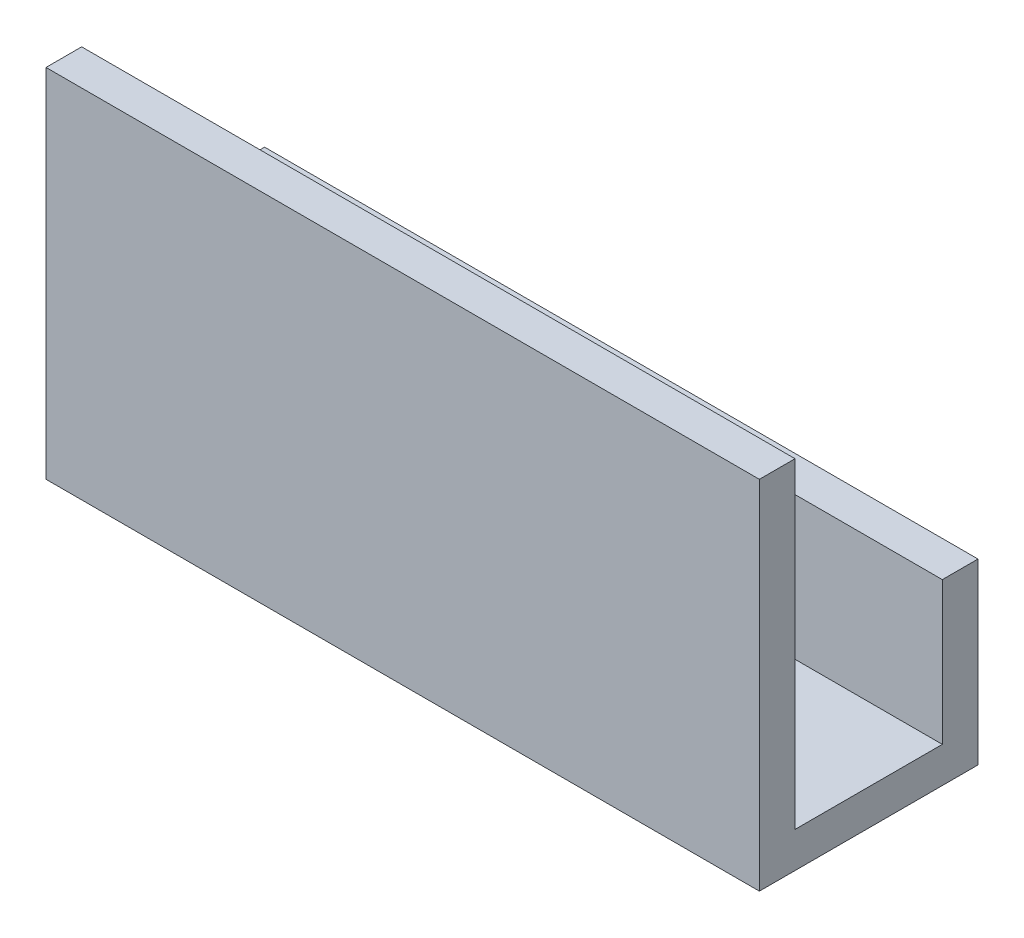
from build123d import *

# Parameters (mm, degrees)
BOSS_EXTRUDE1_DEPTH = 25.4


with BuildPart() as part:
    # Sketch1 → Boss-Extrude1 (new, symmetric)
    with BuildSketch(Plane(origin=(0, 0, 0), x_dir=(0, 0, -1), z_dir=(1, 0, 0))):
        Polygon((7.78383, 0), (-7.78383, 0), (-7.78383, 25.4), (-5.24383, 25.4), (-5.24383, 2.54), (5.24383, 2.54), (5.24383, 12.7), (7.78383, 12.7), align=None)
    extrude(amount=BOSS_EXTRUDE1_DEPTH, both=True)


solid = part.part
